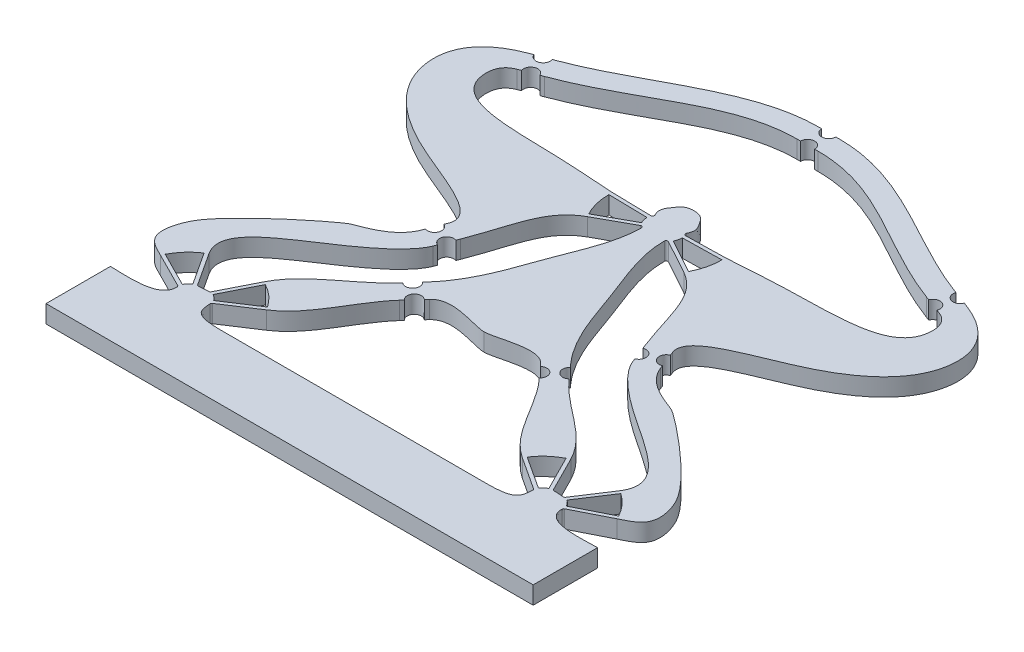
from build123d import *

# Parameters (mm, degrees)
BOSS_EXTRUDE1_DEPTH = 10


with BuildPart() as part:
    # Sketch4 → Boss-Extrude1 (new body)
    with BuildSketch(Plane(origin=(0, 0, 0), x_dir=(1, 0, 0), z_dir=(0, 1, 0))):
        with BuildLine():
            Line((-38.188159042, 60.09491636), (-39.521492374, 58.604204374))
            add(Edge.make_bspline(
                [(-72.428706213, 16.24265246), (-57.393123442, 26.077796633), (-51.441906178, 45.276776582), (-39.521492374, 58.604204374)],
                knots=[0, 0, 0, 0, 1, 1, 1, 1], degree=3))
            Line((-72.428706213, 16.24265246), (-90.904935064, 4.156897136))
            ThreePointArc((-90.904935064, 4.156897136), (-91.250027124, 3.771072484), (-91.355973288, 3.264392503))
            add(Edge.make_bspline(
                [(-91.355973288, 3.264392503), (-91.137412244, -0.657526294), (-90.257716263, -4.90666411), (-83.076574796, -6.581863165), (-75.265123248, -6.581863165)],
                knots=[0, 0, 0, 0, 0.476480286, 1, 1, 1, 1], degree=3))
            Line((-75.265123248, -6.581863165), (0, -6.581863165))
            Line((0, -6.581863165), (0, -43.045016767))
            Line((0, -43.045016767), (-137.873440008, -43.045016767))
            Line((-137.873440008, -43.045016767), (-137.873440008, -6.581863165))
            add(Edge.make_bspline(
                [(-108.95321309, 2.28373194), (-108.318643515, -9.103157055), (-129.445483573, -6.581863165), (-137.873440008, -6.581863165)],
                knots=[0, 0, 0, 0, 1, 1, 1, 1], degree=3))
            ThreePointArc((-108.95321309, 2.28373194), (-109.114801011, 2.775502757), (-109.500625663, 3.120594817))
            Line((-109.500625663, 3.120594817), (-129.205311222, 13.078600706))
            add(Edge.make_bspline(
                [(-129.205311222, 13.078600706), (-136.208321249, 16.617658199), (-144.856819898, 19.540294143), (-133.681432118, 48.693830745), (-96.198628871, 79.267307211), (-87.850383543, 83.678468652), (-71.858686847, 88.590660492), (-67.771063343, 99.062079691)],
                knots=[0, 0, 0, 0, 0.398716688, 0.477575962, 0.754035326, 0.809733472, 1, 1, 1, 1], degree=3))
            Line((-67.771063343, 99.062079691), (-67.043790616, 100.925161649))
            ThreePointArc((-67.043790616, 100.925161649), (-61.863081957, 103.196780387), (-64.134699707, 108.377489479))
            Line((-64.134699707, 108.377489479), (-63.407426979, 110.240571436))
            add(Edge.make_bspline(
                [(-123.643750179, 216.383248449), (-146.450625439, 207.86217325), (-155.131512498, 174.125749926), (-116.986794557, 138.227232781), (-58.429591821, 122.992479383), (-63.407426979, 110.240571436)],
                knots=[0, 0, 0, 0, 0.283698631, 0.638823971, 1, 1, 1, 1], degree=3))
            Line((-123.643750179, 216.383248449), (-121.770242393, 217.083226002))
            ThreePointArc((-121.770242393, 217.083226002), (-116.623271833, 214.736165853), (-114.276211247, 219.883136213))
            Line((-114.276211247, 219.883136213), (-112.402703461, 220.583113766))
            add(Edge.make_bspline(
                [(-112.402703461, 220.583113766), (-76.730376789, 233.910962259), (-44.089424314, 262.173769149), (-6, 262.173769149)],
                knots=[0, 0, 0, 0, 1, 1, 1, 1], degree=3))
            Line((-6, 262.173769149), (-4, 262.173769149))
            ThreePointArc((-4, 262.173769149), (-2.828427125, 259.345342024), (0, 258.173769149))
            Line((0, 258.173769149), (0, 254.173769149))
            ThreePointArc((0, 254.173769149), (-2.828427125, 253.002196274), (-4, 250.173769149))
            Line((-4, 250.173769149), (-6, 250.173769149))
            add(Edge.make_bspline(
                [(-108.202838382, 209.342067685), (-69.239563588, 223.899475954), (-42.68582532, 250.173769149), (-6, 250.173769149)],
                knots=[0, 0, 0, 0, 1, 1, 1, 1], degree=3))
            Line((-108.202838382, 209.342067685), (-110.076346168, 208.642090132))
            ThreePointArc((-110.076346168, 208.642090132), (-115.223316728, 210.98915028), (-117.570377314, 205.842179921))
            Line((-117.570377314, 205.842179921), (-119.4438851, 205.142202368))
            add(Edge.make_bspline(
                [(-119.4438851, 205.142202368), (-125.671665833, 202.815386996), (-131.195665925, 172.228367493), (-78.301604385, 175.640544072), (-35.271953311, 171.758955756), (-31.928338207, 171.691925306)],
                knots=[0, 0, 0, 0, 0.124419451, 0.710010278, 1, 1, 1, 1], degree=3))
            Line((-31.928338207, 171.691925306), (-9.854808922, 171.249410672))
            ThreePointArc((-9.854808922, 171.249410672), (-8.984162865, 171.72340098), (-8.949396824, 172.714099063))
            add(Edge.make_bspline(
                [(-8.949396824, 172.714099063), (-10.970561894, 176.563352288), (-7.616484748, 181.238960263), (-4.813614966, 185.898359068), (0, 185.898359068)],
                knots=[0, 0, 0, 0, 0.470592774, 1, 1, 1, 1], degree=3))
            Line((0, 185.898359068), (0, 67.082039325))
            add(Edge.make_bspline(
                [(-31.521492374, 67.548476284), (-24.530153352, 75.365030938), (-6.558610981, 67.082038446), (0, 67.082039325)],
                knots=[0, 0, 0, 0, 1, 1, 1, 1], degree=3))
            Line((-31.521492374, 67.548476284), (-32.854825708, 66.0577643))
            ThreePointArc((-32.854825708, 66.0577643), (-38.509294824, 65.748712081), (-38.188159042, 60.09491636))
        make_face()
        with BuildLine():
            Line((-47.145174292, 68.10631435), (-48.478507625, 66.615602365))
            add(Edge.make_bspline(
                [(-86.921399294, 29.205311222), (-78.81777474, 45.240587312), (-60.398921429, 53.288174573), (-48.478507625, 66.615602365)],
                knots=[0, 0, 0, 0, 1, 1, 1, 1], degree=3))
            Line((-86.921399294, 29.205311222), (-96.879405183, 9.500625663))
            ThreePointArc((-96.879405183, 9.500625663), (-97.224497243, 9.114801011), (-97.71626806, 8.95321309))
            Line((-97.71626806, 8.95321309), (-103.264392503, 8.644026712))
            ThreePointArc((-103.264392503, 8.644026712), (-103.771072484, 8.749972876), (-104.156897136, 9.095064936))
            Line((-104.156897136, 9.095064936), (-116.24265246, 27.571293787))
            add(Edge.make_bspline(
                [(-116.24265246, 27.571293787), (-124.057861826, 39.518879429), (-106.016533404, 54.593099811), (-73.947077037, 74.401917093), (-59.028593052, 88.457999552), (-56.592573021, 94.698443883)],
                knots=[0, 0, 0, 0, 0.503887474, 0.777241369, 1, 1, 1, 1], degree=3))
            Line((-56.592573021, 94.698443883), (-55.865300293, 96.561525841))
            ThreePointArc((-55.865300293, 96.561525841), (-58.136918043, 101.742234932), (-52.956209384, 104.01385367))
            Line((-52.956209384, 104.01385367), (-52.228936657, 105.876935628))
            add(Edge.make_bspline(
                [(-27.273316425, 152.813380681), (-42.793312797, 144.263005323), (-43.949660773, 127.086268717), (-52.228936657, 105.876935628)],
                knots=[0, 0, 0, 0, 1, 1, 1, 1], degree=3))
            Line((-27.273316425, 152.813380681), (-7.935821997, 163.466916409))
            ThreePointArc((-7.935821997, 163.466916409), (-6.944626107, 163.452014183), (-6.453280422, 162.591043343))
            add(Edge.make_bspline(
                [(-6.453280422, 162.591043343), (-6.453280422, 148.771243113), (-20.026584921, 119.21107103), (-28.059610246, 89.444623647), (-40.478507625, 75.559874275)],
                knots=[0, 0, 0, 0, 0.440913928, 1, 1, 1, 1], degree=3))
            Line((-40.478507625, 75.559874275), (-41.811840958, 74.06916229))
            ThreePointArc((-41.811840958, 74.06916229), (-41.490705176, 68.415366569), (-47.145174292, 68.10631435))
        make_face(mode=Mode.SUBTRACT)
        with BuildLine():
            Line((-95.049006943, 8.688363928), (-85.122286471, 28.331142585))
            ThreePointArc((-85.122286471, 28.331142585), (-78.666666667, 23.85139176), (-73.497363414, 17.933495309))
            Line((-73.497363414, 17.933495309), (-91.915544848, 5.885710228))
            ThreePointArc((-91.915544848, 5.885710228), (-93.333333333, 7.453559925), (-95.049006943, 8.688363928))
        make_face(mode=Mode.SUBTRACT)
        with BuildLine():
            Line((-8.989046189, 165.170103317), (-28.265787332, 154.550038176))
            ThreePointArc((-28.265787332, 154.550038176), (-31.069419685, 161.890531357), (-31.999687563, 169.692953814))
            Line((-31.999687563, 169.692953814), (-9.995507461, 169.251829444))
            ThreePointArc((-9.995507461, 169.251829444), (-9.709193652, 167.157479601), (-8.989046189, 165.170103317))
        make_face(mode=Mode.SUBTRACT)
        with BuildLine():
            Line((-108.688363928, 4.950993057), (-128.331142585, 14.877713529))
            ThreePointArc((-128.331142585, 14.877713529), (-123.85139176, 21.333333333), (-117.933495309, 26.502636586))
            Line((-117.933495309, 26.502636586), (-105.885710228, 8.084455152))
            ThreePointArc((-105.885710228, 8.084455152), (-107.453559925, 6.666666667), (-108.688363928, 4.950993057))
        make_face(mode=Mode.SUBTRACT)
    extrude(amount=BOSS_EXTRUDE1_DEPTH)

    # Mirror1: part across plane


with BuildPart() as part_1:
    add(part.part)
    add(part.part.mirror(Plane(origin=(0, 10, 0), x_dir=(0, 0, 1), z_dir=(1, 0, 0))))


solid = part_1.part
